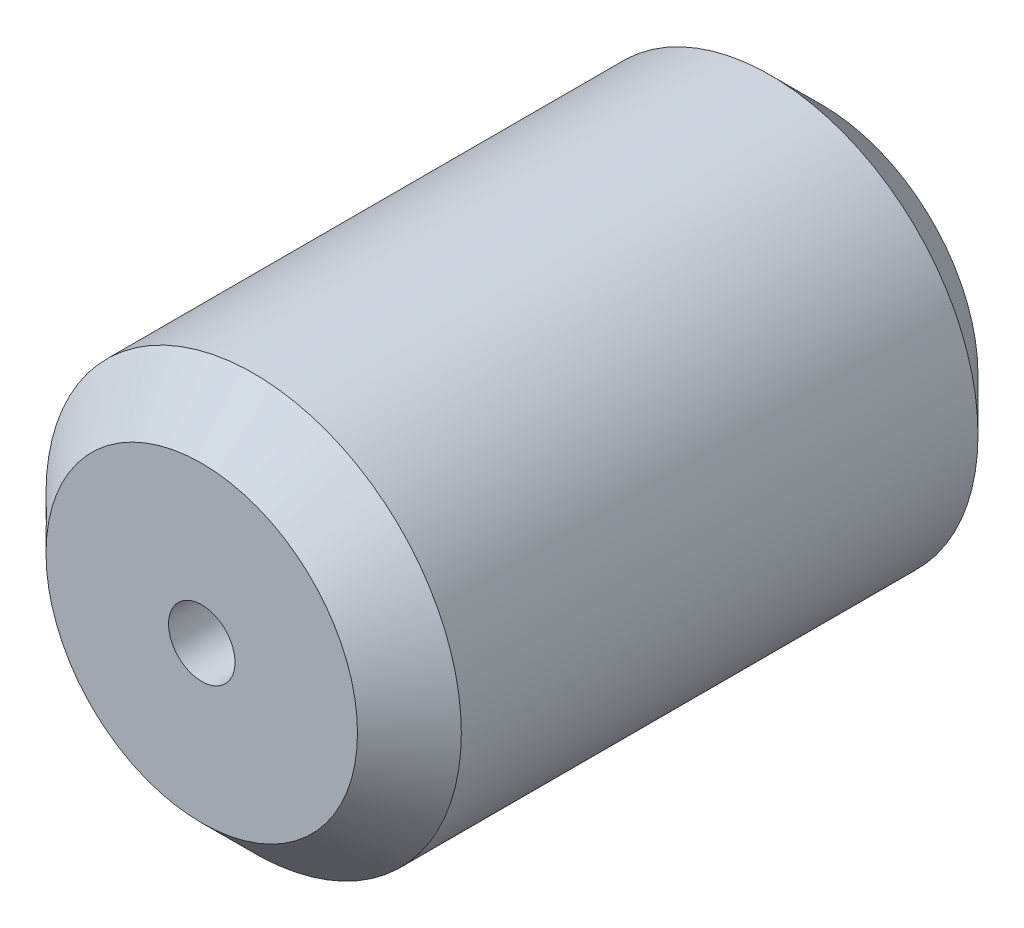
from build123d import *

# Parameters (mm, degrees)
BOSS_EXTRUDE1_DEPTH      = 9.4869
BOSS_EXTRUDE1_DEPTH_BACK = 9.4869
SKETCH1_R                = 6.35
SKETCH1_R_2              = 1.016
CHAMFER1_SIZE            = 1.5875


with BuildPart() as part:
    # Sketch1 → Boss-Extrude1 (new, two sides: drawn at the far end of the back side and taken through both)
    with BuildSketch(Plane.XY.offset(-BOSS_EXTRUDE1_DEPTH_BACK)):
        Circle(SKETCH1_R)
        Circle(SKETCH1_R_2, mode=Mode.SUBTRACT)
    extrude(amount=BOSS_EXTRUDE1_DEPTH + BOSS_EXTRUDE1_DEPTH_BACK)

    # Chamfer1
    chamfer1_edges = [part.edges().sort_by_distance(p)[0] for p in [
        (-6.35, 0, -9.4869),
        (-6.35, 0, 9.4869),
    ]]
    chamfer(chamfer1_edges, length=CHAMFER1_SIZE)


solid = part.part
